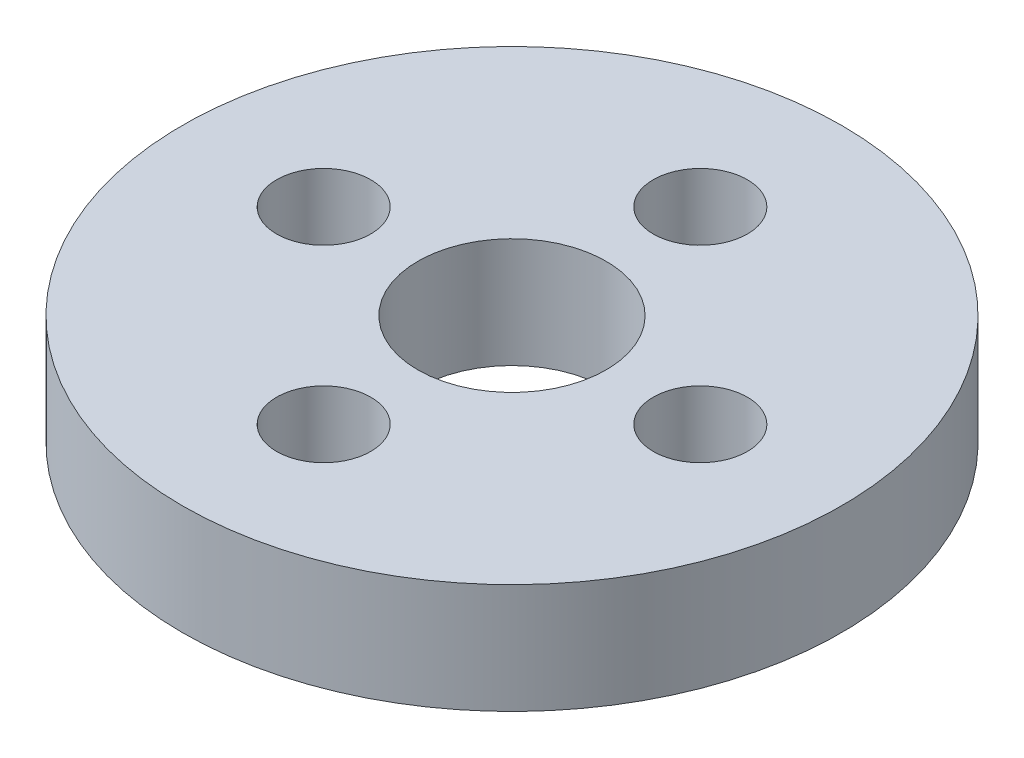
from build123d import *

# Parameters (mm, degrees)
SKETCH1_R           = 10.5
BOSS_EXTRUDE1_DEPTH = 3.5
SKETCH2_R           = 3
SKETCH2_R_2         = 1.5
CUT_EXTRUDE1_DEPTH  = 10.2


with BuildPart() as part:
    # Sketch1 → Boss-Extrude1 (new body)
    with BuildSketch(Plane(origin=(0, 0, 0), x_dir=(1, 0, 0), z_dir=(0, 1, 0))):
        with Locations(Location((0, 0, 0), (0, 0, 90))):
            Circle(SKETCH1_R)
    extrude(amount=BOSS_EXTRUDE1_DEPTH)

    # Sketch2 → Cut-Extrude1 (cut)
    with BuildSketch(Plane(origin=(0, 3.5, 0), x_dir=(1, 0, 0), z_dir=(0, 1, 0))):
        with Locations(Location((0, 0, 0), (0, 0, 270))):
            Circle(SKETCH2_R)
        with Locations(Location((0, 6, 0), (0, 0, 270))):
            Circle(SKETCH2_R_2)
        with Locations(Location((6, 0, 0), (0, 0, 270))):
            Circle(SKETCH2_R_2)
        with Locations(Location((0, -6, 0), (0, 0, 270))):
            Circle(SKETCH2_R_2)
        with Locations(Location((-6, 0, 0), (0, 0, 270))):
            Circle(SKETCH2_R_2)
    extrude(amount=-CUT_EXTRUDE1_DEPTH, mode=Mode.SUBTRACT)


solid = part.part
